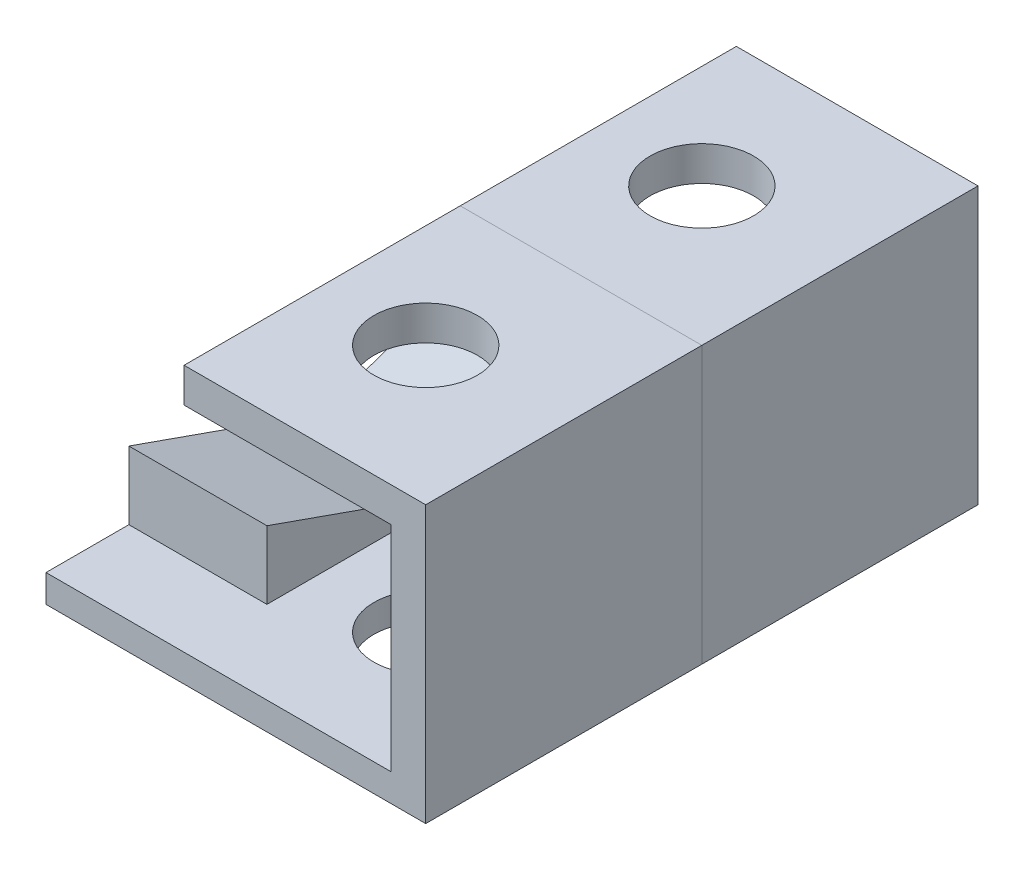
from build123d import *

# Parameters (mm, degrees)
SKETCH1_W           = 31.75
SKETCH1_H           = 25.4
SKETCH1_R           = 4.7625
BOSS_EXTRUDE1_DEPTH = 2.54
SKETCH1_3_W         = 12.7
SKETCH1_3_H         = 17.655412268
BOSS_EXTRUDE2_DEPTH = 2.54
SKETCH1_4_W         = 3.175
SKETCH1_4_H         = 25.4
BOSS_EXTRUDE3_DEPTH = 25.4
SKETCH2_W           = 25.4
SKETCH2_H           = 3.175
BOSS_EXTRUDE4_DEPTH = 19.05
CUT_EXTRUDE1_START  = -3.175
SKETCH4_R           = 4.7625
CUT_EXTRUDE1_DEPTH  = 3.175
BOSS_EXTRUDE5_DEPTH = 12.7


with BuildPart() as part:
    # Sketch1 → Boss-Extrude1 (new body)
    with BuildSketch(Plane(origin=(0, 0, 0), x_dir=(1, 0, 0), z_dir=(0, 1, 0))):
        with Locations((15.875, 12.7)):
            Rectangle(SKETCH1_W, SKETCH1_H)
        with Locations((22.225, 12.7)):
            Circle(SKETCH1_R, mode=Mode.SUBTRACT)
    extrude(amount=BOSS_EXTRUDE1_DEPTH)

    # Sketch1<3> → Boss-Extrude2 (add)
    with BuildSketch(Plane(origin=(0, 0, 0), x_dir=(1, 0, 0), z_dir=(0, 1, 0))):
        with Locations((6.35, 8.827706134)):
            Rectangle(SKETCH1_3_W, SKETCH1_3_H)
    extrude(amount=BOSS_EXTRUDE2_DEPTH)

    # Sketch1<4> → Boss-Extrude3 (add)
    with BuildSketch(Plane(origin=(0, 0, 0), x_dir=(1, 0, 0), z_dir=(0, 1, 0))):
        with Locations((33.3375, 12.7)):
            Rectangle(SKETCH1_4_W, SKETCH1_4_H)
    extrude(amount=BOSS_EXTRUDE3_DEPTH)

    # Sketch2 → Boss-Extrude4 (add)
    with BuildSketch(Plane.ZY.offset(-31.75)):
        with Locations((-12.7, 23.8125)):
            Rectangle(SKETCH2_W, SKETCH2_H)
    extrude(amount=BOSS_EXTRUDE4_DEPTH)

    # Sketch4 → Cut-Extrude1 (cut)
    with BuildSketch(Plane(origin=(0, 25.4, 0), x_dir=(1, 0, 0), z_dir=(0, 1, 0)).offset(CUT_EXTRUDE1_START)):
        with Locations((22.225, 12.7)):
            Circle(SKETCH4_R)
    extrude(amount=CUT_EXTRUDE1_DEPTH, mode=Mode.SUBTRACT)

    # Sketch16 → Boss-Extrude5 (add)
    with BuildSketch(Plane.ZY):
        Polygon((-17.778601637, 2.54), (-17.778601637, 8.805137728), (0, 2.54), align=None)
    extrude(amount=-BOSS_EXTRUDE5_DEPTH)


with BuildPart() as body_2:
    # Mirror3: mirrored copy
    add(part.part.mirror(Plane(origin=(0, 2.54, 0), x_dir=(1, 0, 0), z_dir=(0, 0, -1))))


solid = Compound([part.part, body_2.part])
